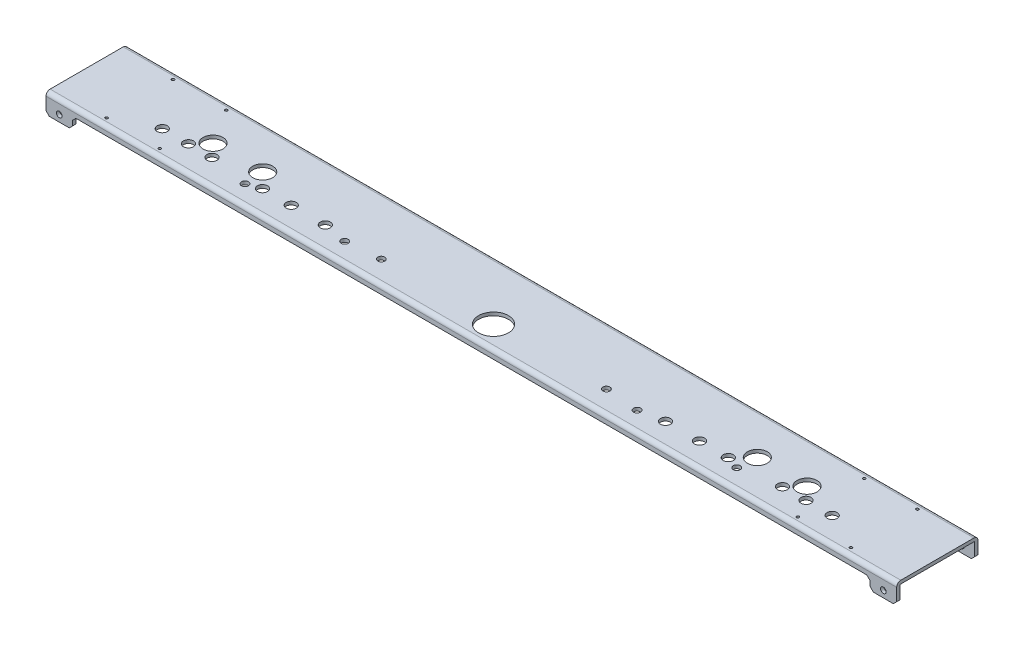
from build123d import *

# Parameters (mm, degrees)
SKETCH1_W                       = 812.8
SKETCH1_H                       = 77.724
BOSS_EXTRUDE1_DEPTH             = 19.05
SKETCH2_W                       = 71.374
SKETCH2_H                       = 15.875
CUT_EXTRUDE1_DEPTH              = 817.296745672
CUT_EXTRUDE2_REACH              = 818.662
SKETCH3_W                       = 762
SKETCH3_H                       = 11.1125
HOLE1_D                         = 28.575
HOLE1_DEPTH                     = 19.05
HOLE2_D                         = 9.652
HOLE2_DEPTH                     = 19.05
F_2_CLEARANCE_HOLE1_D           = 2.54
F_2_CLEARANCE_HOLE1_DEPTH       = 19.05
F_3_4_0_75_DIAMETER_HOLE1_D     = 19.05
F_3_4_0_75_DIAMETER_HOLE1_DEPTH = 19.05
F_1_4_CLEARANCE_HOLE1_D         = 6.7056
F_1_4_CLEARANCE_HOLE1_DEPTH     = 19.05
F_10_CLEARANCE_HOLE1_D          = 5.334
F_10_CLEARANCE_HOLE1_DEPTH      = 3.175
F_10_CLEARANCE_HOLE2_D          = 5.334
F_10_CLEARANCE_HOLE2_DEPTH      = 77.724
CHAMFER1_SIZE                   = 3.175
FILLET1_R                       = 0.762
FILLET2_R                       = 3.937


with BuildPart() as part:
    # Sketch1 → Boss-Extrude1 (new body)
    with BuildSketch(Plane.XZ.offset(15.875)):
        with Locations((406.4, -34.925)):
            Rectangle(SKETCH1_W, SKETCH1_H)
    extrude(amount=-BOSS_EXTRUDE1_DEPTH)

    # Sketch2 → Cut-Extrude1 (cut, through all)
    with BuildSketch(Plane.ZY):
        with Locations((-34.925, -7.9375)):
            Rectangle(SKETCH2_W, SKETCH2_H)
    extrude(amount=-CUT_EXTRUDE1_DEPTH, mode=Mode.SUBTRACT)

    # Sketch3 → Cut-Extrude2 (cut, up to next)
    with BuildSketch(Plane.XY.offset(3.937), mode=Mode.PRIVATE) as cut_extrude2_sk1:
        with Locations((406.4, -10.31875)):
            Rectangle(SKETCH3_W, SKETCH3_H)
    cut_extrude2_tool1 = extrude(cut_extrude2_sk1.sketch, amount=-CUT_EXTRUDE2_REACH, mode=Mode.PRIVATE) & part.part
    add(cut_extrude2_tool1.solids().sort_by_distance((406.4, -10.31875, 3.937))[0], mode=Mode.SUBTRACT)

    # Hole1
    with Locations(Plane(origin=(0, 3.175, 0), x_dir=(1, 0, 0), z_dir=(0, 1, 0))):
        with Locations((406.4, 17.272)):
            Hole(HOLE1_D / 2, depth=HOLE1_DEPTH)

    # Hole2
    with Locations(Plane(origin=(0, 3.175, 0), x_dir=(1, 0, 0), z_dir=(0, 1, 0))):
        with Locations((568.924874752, 19.05), (601.438495912, 19.05), (628.947697627, 19.05), (243.875125248, 19.05), (211.361504088, 19.05), (183.852302373, 19.05), (678.944202666, 20.828), (701.450372003, 20.828), (726.460886343, 20.828), (133.855797334, 20.828), (111.349627997, 20.828), (86.339113657, 20.828)):
            Hole(HOLE2_D / 2, depth=HOLE2_DEPTH)

    # #2 Clearance Hole1
    with Locations(Plane(origin=(0, 3.175, 0), x_dir=(1, 0, 0), z_dir=(0, 1, 0))):
        with Locations((711.2, 3.175), (711.2, 66.675), (762, 3.175), (762, 66.675), (101.6, 3.175), (50.8, 3.175), (101.6, 66.675), (50.8, 66.675)):
            Hole(F_2_CLEARANCE_HOLE1_D / 2, depth=F_2_CLEARANCE_HOLE1_DEPTH)

    # 3/4 (0.75) Diameter Hole1
    with Locations(Plane(origin=(0, 3.175, 0), x_dir=(1, 0, 0), z_dir=(0, 1, 0))):
        with Locations((690.197287335, 33.02), (642.712889143, 33.02), (170.087110857, 33.02), (122.602712665, 33.02)):
            Hole(F_3_4_0_75_DIAMETER_HOLE1_D / 2, depth=F_3_4_0_75_DIAMETER_HOLE1_DEPTH)

    # 1/4 Clearance Hole1
    with Locations(Plane(origin=(0, 3.175, 0), x_dir=(1, 0, 0), z_dir=(0, 1, 0))):
        with Locations((641.35, 14.732), (546.1, 14.732), (171.45, 14.732), (266.7, 14.732), (513.925467617, 17.547282407), (298.874532383, 17.547282407)):
            Hole(F_1_4_CLEARANCE_HOLE1_D / 2, depth=F_1_4_CLEARANCE_HOLE1_DEPTH)

    # #10 Clearance Hole1
    with Locations(Plane(origin=(0, 0, 0.762), x_dir=(-1, 0, 0), z_dir=(0, 0, -1))):
        with Locations((-12.7, -9.525), (-800.1, -9.525)):
            Hole(F_10_CLEARANCE_HOLE1_D / 2, depth=F_10_CLEARANCE_HOLE1_DEPTH)

    # #10 Clearance Hole2
    with Locations(Plane(origin=(0, 0, -73.787), x_dir=(-1, 0, 0), z_dir=(0, 0, -1))):
        with Locations((-800.1, -9.525), (-774.7, -9.525), (-749.3, -9.525), (-723.9, -9.525), (-698.5, -9.525), (-673.1, -9.525), (-647.7, -9.525), (-622.3, -9.525), (-596.9, -9.525), (-571.5, -9.525), (-546.1, -9.525), (-520.7, -9.525), (-495.3, -9.525), (-469.9, -9.525), (-444.5, -9.525), (-419.1, -9.525), (-393.7, -9.525), (-368.3, -9.525), (-342.9, -9.525), (-317.5, -9.525), (-292.1, -9.525), (-266.7, -9.525), (-241.3, -9.525), (-215.9, -9.525), (-190.5, -9.525), (-165.1, -9.525), (-139.7, -9.525), (-114.3, -9.525), (-88.9, -9.525), (-63.5, -9.525), (-38.1, -9.525), (-12.7, -9.525)):
            Hole(F_10_CLEARANCE_HOLE2_D / 2, depth=F_10_CLEARANCE_HOLE2_DEPTH)

    # Chamfer1
    chamfer1_edges = [part.edges().sort_by_distance(p)[0] for p in [
        (812.8, -15.875, 2.3495),
        (0, -15.875, -72.1995),
        (787.4, -4.7625, 2.3495),
        (25.4, -4.7625, 2.3495),
        (25.4, -15.875, 2.3495),
        (787.4, -15.875, 2.3495),
        (0, -15.875, 2.3495),
        (812.8, -15.875, -72.1995),
    ]]
    chamfer(chamfer1_edges, length=CHAMFER1_SIZE)

    # Fillet1
    fillet1_edges = [part.edges().sort_by_distance(p)[0] for p in [
        (406.4, 0, -70.612),
        (406.4, 0, 0.762),
    ]]
    fillet(fillet1_edges, radius=FILLET1_R)

    # Fillet2
    fillet2_edges = [part.edges().sort_by_distance(p)[0] for p in [
        (406.4, 3.175, -73.787),
        (406.4, 3.175, 3.937),
    ]]
    fillet(fillet2_edges, radius=FILLET2_R)


solid = part.part
